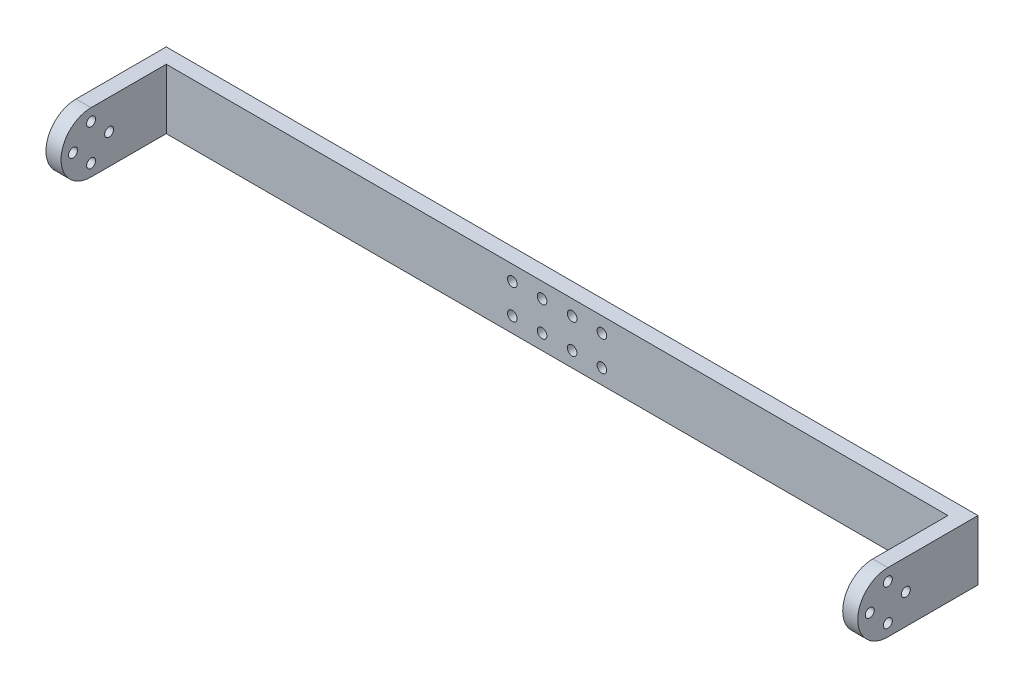
from build123d import *

# Parameters (mm, degrees)
SKETCH_1_W          = 270
SKETCH_1_H          = 20
EXTRUDE_1_DEPTH     = 5
SKETCH_2_W          = 5
SKETCH_2_H          = 20
EXTRUDE_2_DEPTH     = 35
SKETCH_3_W          = 5
SKETCH_3_H          = 20
EXTRUDE_3_DEPTH     = 35
SKETCH_4_R          = 1.6
CUT_EXTRUDE_1_DEPTH = 35
CUT_EXTRUDE_2_DEPTH = 274.130005675
SKETCH_6_R          = 1.5
CUT_EXTRUDE_3_DEPTH = 274.130005675


with BuildPart() as part:
    # 草图1 → 凸台-拉伸1 (new body)
    with BuildSketch(Plane.XY):
        Rectangle(SKETCH_1_W, SKETCH_1_H)
    extrude(amount=EXTRUDE_1_DEPTH)

    # 草图2 → 凸台-拉伸2 (add)
    with BuildSketch(Plane.XY.offset(5)):
        with Locations((-132.5, 0)):
            Rectangle(SKETCH_2_W, SKETCH_2_H)
    extrude(amount=EXTRUDE_2_DEPTH)

    # 草图3 → 凸台-拉伸3 (add)
    with BuildSketch(Plane.XY.offset(5)):
        with Locations((132.5, 0)):
            Rectangle(SKETCH_3_W, SKETCH_3_H)
    extrude(amount=EXTRUDE_3_DEPTH)

    # 草图4 → 切除-拉伸1 (cut)
    with BuildSketch(Plane(origin=(0, 0, 0), x_dir=(-1, 0, 0), z_dir=(0, 0, -1))):
        with Locations((5, 4.95)):
            Circle(SKETCH_4_R)
        with Locations((14.9, 4.95)):
            Circle(SKETCH_4_R)
        with Locations(Location((-14.9, 4.95, 0), (0, 0, 180))):
            Circle(SKETCH_4_R)
        with Locations(Location((-5, 4.95, 0), (0, 0, 180))):
            Circle(SKETCH_4_R)
        with Locations(Location((14.9, -4.95, 0), (0, 0, 180))):
            Circle(SKETCH_4_R)
        with Locations(Location((5, -4.95, 0), (0, 0, 180))):
            Circle(SKETCH_4_R)
        with Locations((-5, -4.95)):
            Circle(SKETCH_4_R)
        with Locations((-14.9, -4.95)):
            Circle(SKETCH_4_R)
    extrude(amount=-CUT_EXTRUDE_1_DEPTH, mode=Mode.SUBTRACT)

    # 草图5 → 切除-拉伸2 (cut, through all)
    with BuildSketch(Plane(origin=(135, 0, 0), x_dir=(0, 0, -1), z_dir=(1, 0, 0))):
        with BuildLine():
            ThreePointArc((-40, 0), (-37.071067812, 7.071067812), (-30, 10))
            Line((-30, 10), (-40, 10))
            Line((-40, 10), (-40, 0))
        make_face()
        with BuildLine():
            ThreePointArc((-30, -10), (-37.071067812, -7.071067812), (-40, 0))
            Line((-40, 0), (-40, -10))
            Line((-40, -10), (-30, -10))
        make_face()
    extrude(amount=-CUT_EXTRUDE_2_DEPTH, mode=Mode.SUBTRACT)

    # 草图6 → 切除-拉伸3 (cut, through all)
    with BuildSketch(Plane.ZY.offset(135)):
        with BuildLine():
            ThreePointArc((31.5, -6), (31.060660172, -4.939339828), (30, -4.5))
            Line((30, -4.5), (30, -7.5))
            ThreePointArc((30, -7.5), (31.060660172, -7.060660172), (31.5, -6))
        make_face()
        with BuildLine():
            Line((30, -7.5), (30, -4.5))
            ThreePointArc((30, -4.5), (28.5, -6), (30, -7.5))
        make_face()
        with Locations((24, 0)):
            Circle(SKETCH_6_R)
        with Locations((36, 0)):
            Circle(SKETCH_6_R)
        with BuildLine():
            ThreePointArc((31.5, 6), (31.060660172, 7.060660172), (30, 7.5))
            Line((30, 7.5), (30, 4.5))
            ThreePointArc((30, 4.5), (31.060660172, 4.939339828), (31.5, 6))
        make_face()
        with BuildLine():
            Line((30, 4.5), (30, 7.5))
            ThreePointArc((30, 7.5), (28.5, 6), (30, 4.5))
        make_face()
    extrude(amount=-CUT_EXTRUDE_3_DEPTH, mode=Mode.SUBTRACT)


solid = part.part
